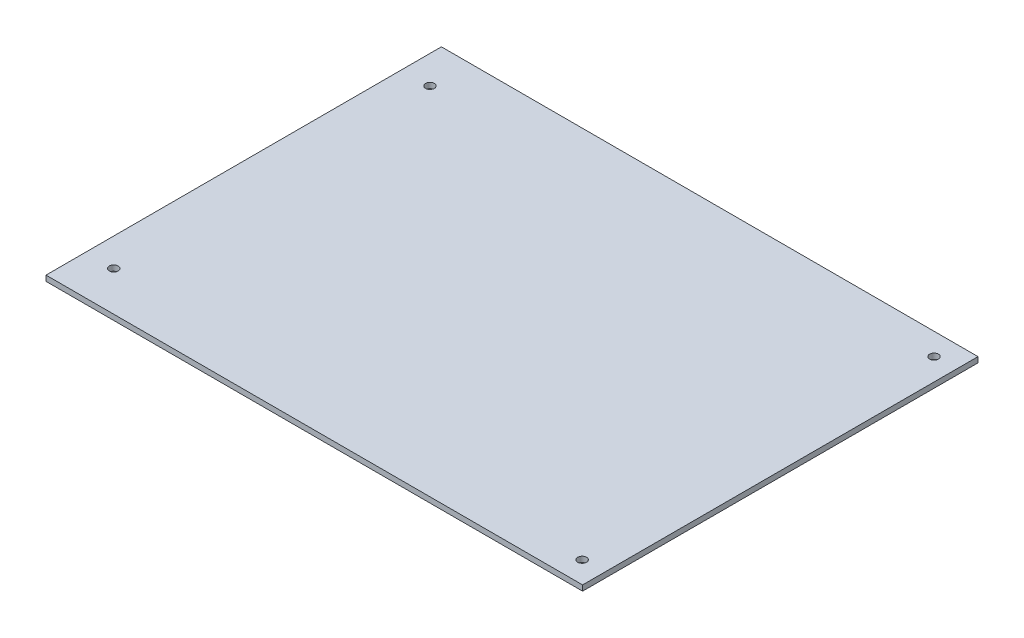
from build123d import *

# Parameters (mm, degrees)
SKETCH1_W           = 154.94
SKETCH1_H           = 114.173
SKETCH1_R           = 1.27
BOSS_EXTRUDE1_DEPTH = 1.5748


with BuildPart() as part:
    # Sketch1 → Boss-Extrude1 (new body)
    with BuildSketch(Plane(origin=(0, 0, 0), x_dir=(1, 0, 0), z_dir=(0, 1, 0))):
        Rectangle(SKETCH1_W, SKETCH1_H)
        with Locations(Location((71.12, -50.8635, 0), (0, 0, 270))):
            Circle(SKETCH1_R, mode=Mode.SUBTRACT)
        with Locations(Location((71.12, 50.7365, 0), (0, 0, 270))):
            Circle(SKETCH1_R, mode=Mode.SUBTRACT)
        with Locations(Location((-69.342, 45.6565, 0), (0, 0, 270))):
            Circle(SKETCH1_R, mode=Mode.SUBTRACT)
        with Locations(Location((-69.342, -45.6565, 0), (0, 0, 270))):
            Circle(SKETCH1_R, mode=Mode.SUBTRACT)
    extrude(amount=BOSS_EXTRUDE1_DEPTH)


solid = part.part
